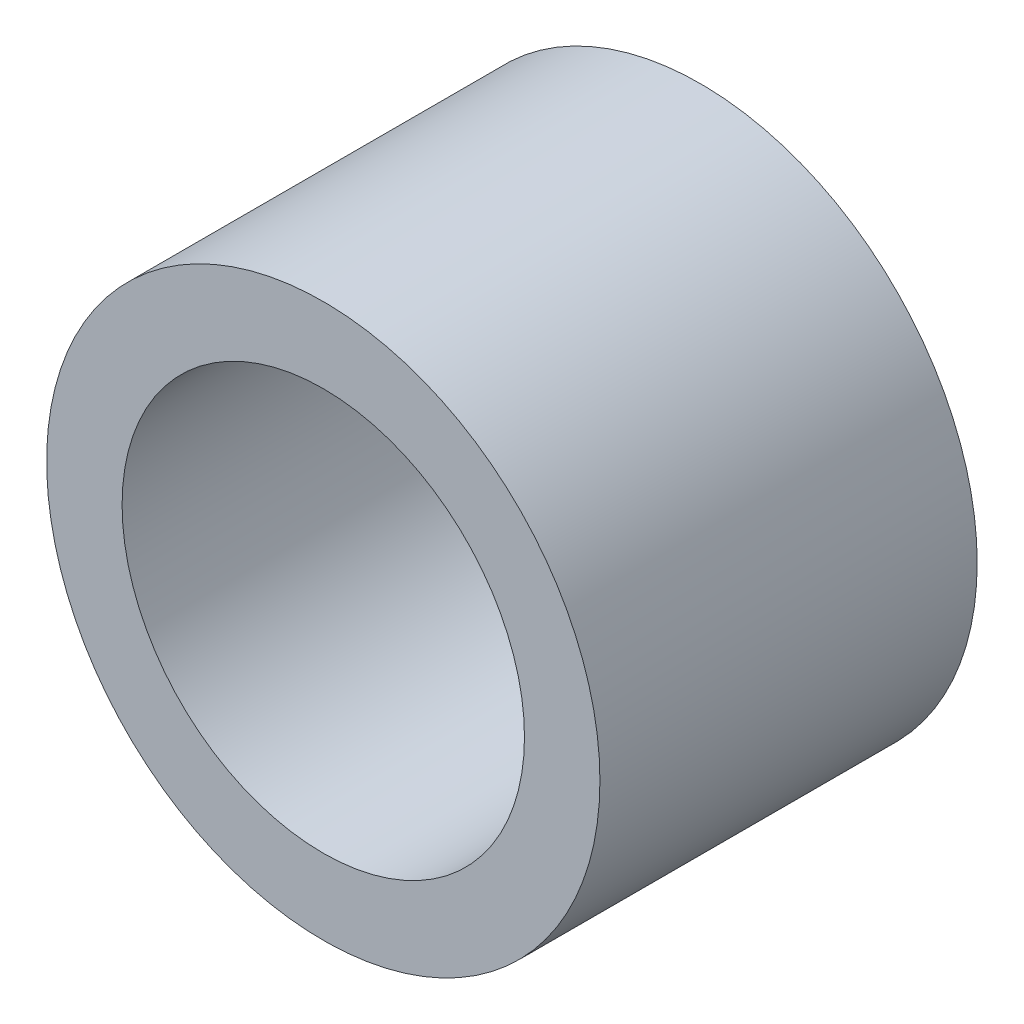
from build123d import *

# Parameters (mm, degrees)
SKETCH_1_R      = 11
SKETCH_1_R_2    = 8
EXTRUDE_1_DEPTH = 15


with BuildPart() as part:
    # 草图1 → 凸台-拉伸1 (new body)
    with BuildSketch(Plane.XY):
        Circle(SKETCH_1_R)
        Circle(SKETCH_1_R_2, mode=Mode.SUBTRACT)
    extrude(amount=EXTRUDE_1_DEPTH)


solid = part.part
